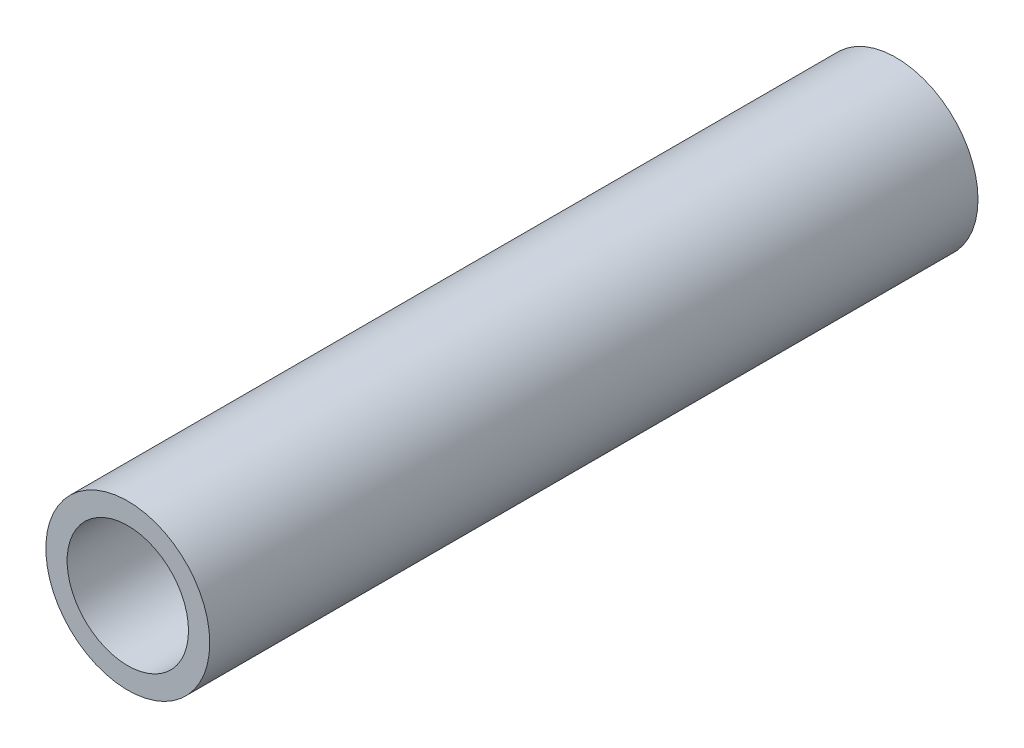
from build123d import *

# Parameters (mm, degrees)
SKETCH1_R           = 10.668
SKETCH1_R_2         = 7.8994
EXTRUDE_THIN1_DEPTH = 50


with BuildPart() as part:
    # Sketch1 → Extrude-Thin1 (new, symmetric)
    with BuildSketch(Plane.XY):
        Circle(SKETCH1_R)
        Circle(SKETCH1_R_2, mode=Mode.SUBTRACT)
    extrude(amount=EXTRUDE_THIN1_DEPTH, both=True)


solid = part.part
